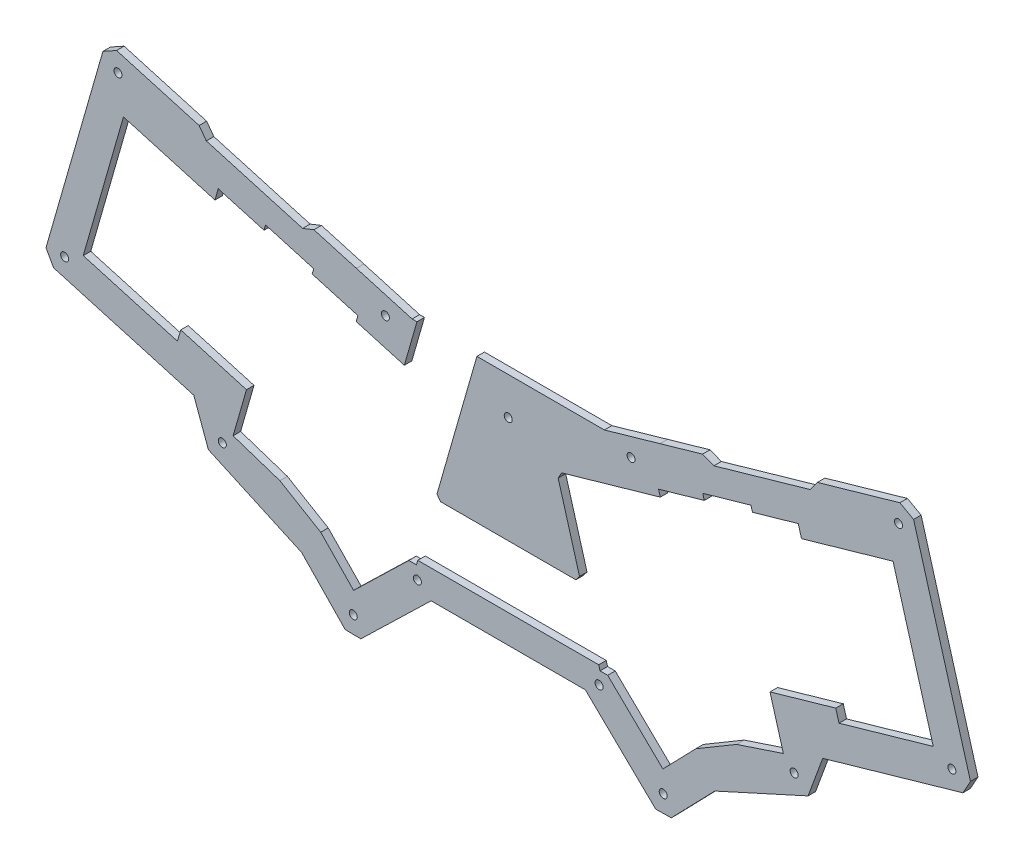
from build123d import *

# Parameters (mm, degrees)
ESQUISSE1_R        = 1.6
BOSS_EXTRU_1_DEPTH = 3


with BuildPart() as part:
    # Esquisse1 → Boss.-Extru.1 (new body)
    with BuildSketch(Plane.XY):
        Polygon((-106.057456456, -118.225792128), (-128.094157446, -96.85509979), (-131.150893181, -96.85509979), (-131.679198628, -95.012679745), (-203.911321115, -95.012679745), (-204.439626562, -96.85509979), (-207.491865187, -96.85509979), (-208.236606037, -97.572971364), (-229.533063287, -118.225792128), (-242.655085998, -104.673746846), (-258.969310369, -95.012679745), (-277.629290011, -88.825419148), (-272.289144354, -70.202118055), (-298.538981418, -62.6750984), (-299.849714513, -67.246167925), (-337.461409717, -56.461187875), (-321.404434006, -0.463858857), (-284.873898651, -10.938821309), (-283.564528345, -6.372504389), (-265.299260667, -11.609985616), (-264.679553884, -9.448811229), (-245.452786066, -14.960840928), (-246.072799476, -17.123084647), (-227.807531798, -22.360565873), (-228.496674065, -24.763890567), (-209.275142378, -30.275576085), (-204.23586614, -12.701531345), (-206.165691337, -12.701531345), (-221.686141291, -8.251113935), (-228.411595336, -6.322621021), (-237.526398495, -3.709541892), (-245.374022141, -1.459744369), (-249.872259625, -3.248768002), (-288.323340616, 7.774587685), (-291.190458161, 11.675149567), (-324.146226634, 21.123080509), (-329.606279511, 18.096325283), (-352.324375235, -61.131089881), (-349.297882974, -66.591026451), (-293.334748244, -82.638197107), (-287.498708924, -98.561018129), (-250.280154874, -115.48724507), (-232.892593163, -133.444615579), (-226.653475651, -133.542771169), (-198.570548361, -106.350948678), (-137.019971382, -106.350948678), (-108.937044092, -133.542771169), (-102.69792658, -133.444615579), (-85.310364869, -115.48724507), (-48.091810819, -98.561018129), (-42.255771499, -82.638197107), (13.707363231, -66.591026451), (16.733855492, -61.131089881), (-5.984240232, 18.096325283), (-11.444293109, 21.123080509), (-44.400061582, 11.675149567), (-47.267179127, 7.774587685), (-85.718260118, -3.248768002), (-90.216497602, -1.459744369), (-98.064121248, -3.709541892), (-107.178924407, -6.322621021), (-113.904378452, -8.251113935), (-129.424828406, -12.701531345), (-180.308979115, -12.701531345), (-196.245732321, -68.279594663), (-194.797007033, -70.202118055), (-140.79351271, -70.202118055), (-139.344787422, -68.279594663), (-147.87312166, -38.537758661), (-146.501872979, -36.063960558), (-107.093845678, -24.763890567), (-107.782987945, -22.360565873), (-89.517720268, -17.123084647), (-90.137733677, -14.960840928), (-70.910965859, -9.448811229), (-70.291259076, -11.609985616), (-52.025991399, -6.372504389), (-50.716621092, -10.938821309), (-14.186085737, -0.463858857), (1.870889973, -56.461187875), (-35.740805231, -67.246167925), (-37.051538325, -62.6750984), (-63.301375389, -70.202118055), (-57.961229733, -88.825419148), (-76.621209374, -95.012679745), (-92.935433745, -104.673746846), align=None)
        with Locations((-229.666591606, -126.713325795)):
            Circle(ESQUISSE1_R, mode=Mode.SUBTRACT)
        with Locations((-204.059552706, -101.880200807)):
            Circle(ESQUISSE1_R, mode=Mode.SUBTRACT)
        with Locations((-281.934339477, -93.401689518)):
            Circle(ESQUISSE1_R, mode=Mode.SUBTRACT)
        with Locations((-344.882804027, -60.574933915)):
            Circle(ESQUISSE1_R, mode=Mode.SUBTRACT)
        with Locations((-105.923928137, -126.713325795)):
            Circle(ESQUISSE1_R, mode=Mode.SUBTRACT)
        with Locations((-131.530967037, -101.880200807)):
            Circle(ESQUISSE1_R, mode=Mode.SUBTRACT)
        with Locations((-53.656180266, -93.401689518)):
            Circle(ESQUISSE1_R, mode=Mode.SUBTRACT)
        with Locations((9.292284284, -60.574933915)):
            Circle(ESQUISSE1_R, mode=Mode.SUBTRACT)
        with Locations((-167.795259872, -27.605548894)):
            Circle(ESQUISSE1_R, mode=Mode.SUBTRACT)
        with Locations((-323.590068827, 13.68165837)):
            Circle(ESQUISSE1_R, mode=Mode.SUBTRACT)
        with Locations((-216.832585966, -16.924131519)):
            Circle(ESQUISSE1_R, mode=Mode.SUBTRACT)
        with Locations((-118.757933777, -16.924131519)):
            Circle(ESQUISSE1_R, mode=Mode.SUBTRACT)
        with Locations((-12.000450916, 13.68165837)):
            Circle(ESQUISSE1_R, mode=Mode.SUBTRACT)
    extrude(amount=BOSS_EXTRU_1_DEPTH)


solid = part.part
